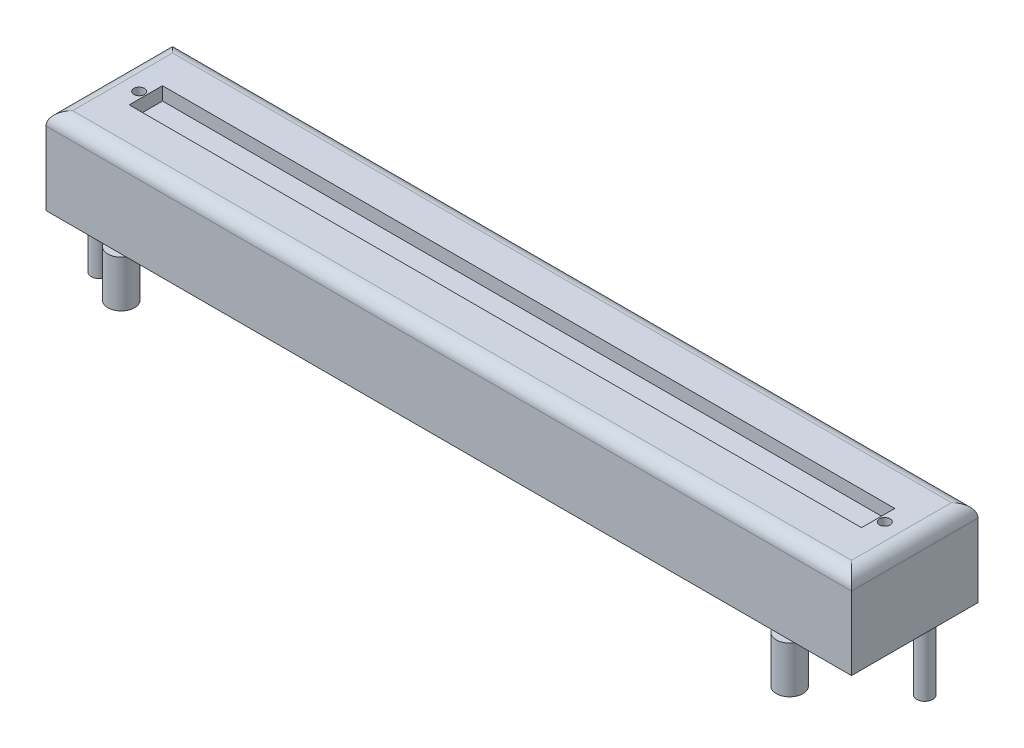
from build123d import *

# Parameters (mm, degrees)
SKETCH1_W           = 60.5
SKETCH1_H           = 9.5
SKETCH1_R           = 0.4
BOSS_EXTRUDE1_DEPTH = 6.5
SKETCH2_R           = 1
BOSS_EXTRUDE2_DEPTH = 3.5
SKETCH2_3_R         = 0.6
BOSS_EXTRUDE3_DEPTH = 5
SKETCH4_W           = 55
SKETCH4_H           = 2.5
CUT_EXTRUDE1_DEPTH  = 1
FILLET1_R           = 1


with BuildPart() as part:
    # Sketch1 → Boss-Extrude1 (new body)
    with BuildSketch(Plane(origin=(0, 0, 0), x_dir=(1, 0, 0), z_dir=(0, 1, 0))):
        Rectangle(SKETCH1_W, SKETCH1_H)
        with Locations((-28, 0)):
            Circle(SKETCH1_R, mode=Mode.SUBTRACT)
        with Locations((28, 0)):
            Circle(SKETCH1_R, mode=Mode.SUBTRACT)
    extrude(amount=BOSS_EXTRUDE1_DEPTH)

    # Sketch2 → Boss-Extrude2 (add)
    with BuildSketch(Plane.XZ):
        with Locations((-25.1, 4.25)):
            Circle(SKETCH2_R)
        with Locations((-23.9, -4.25)):
            Circle(SKETCH2_R)
        with Locations((25.1, 4.25)):
            Circle(SKETCH2_R)
        with Locations((23.9, -4.25)):
            Circle(SKETCH2_R)
    extrude(amount=BOSS_EXTRUDE2_DEPTH)

    # Sketch2<3> → Boss-Extrude3 (add)
    with BuildSketch(Plane.XZ):
        with Locations((-29.25, 1.75)):
            Circle(SKETCH2_3_R)
        with Locations((-29.25, -1.75)):
            Circle(SKETCH2_3_R)
        with Locations((29.25, -1.75)):
            Circle(SKETCH2_3_R)
    extrude(amount=BOSS_EXTRUDE3_DEPTH)

    # Sketch4 → Cut-Extrude1 (cut)
    with BuildSketch(Plane(origin=(0, 6.5, 0), x_dir=(1, 0, 0), z_dir=(0, 1, 0))):
        Rectangle(SKETCH4_W, SKETCH4_H)
    extrude(amount=-CUT_EXTRUDE1_DEPTH, mode=Mode.SUBTRACT)

    # Fillet1
    fillet1_edges = [part.edges().sort_by_distance(p)[0] for p in [
        (30.25, 6.5, 0),
        (0, 6.5, -4.75),
        (-30.25, 6.5, 0),
        (0, 6.5, 4.75),
    ]]
    fillet(fillet1_edges, radius=FILLET1_R)


solid = part.part
